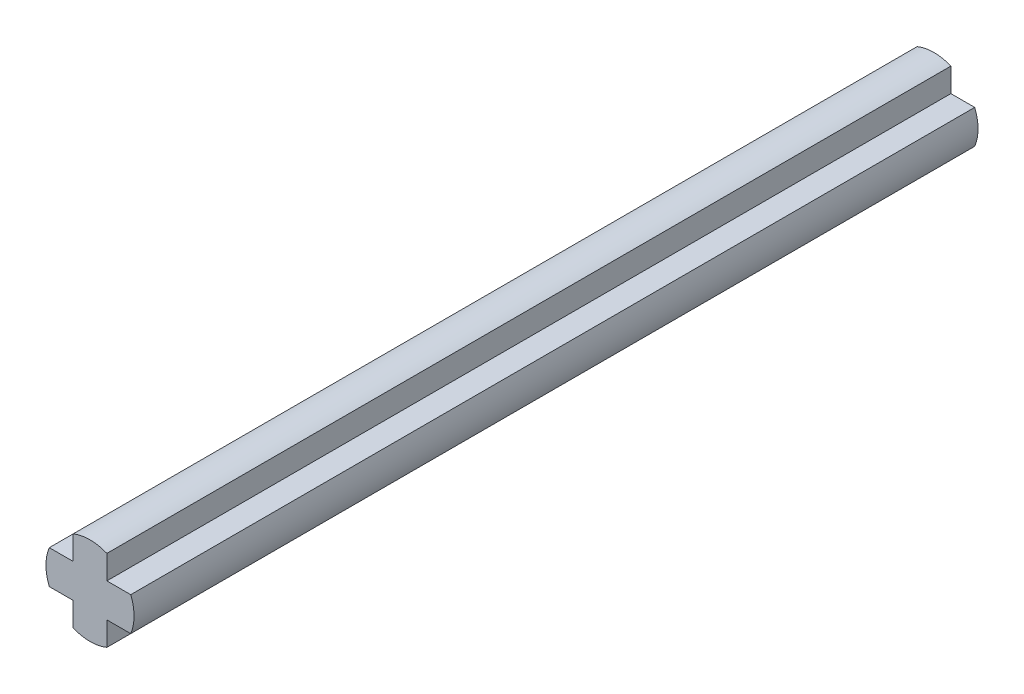
from build123d import *

# Parameters (mm, degrees)
BOSS_EXTRUDE1_DEPTH = 45


with BuildPart() as part:
    # Sketch1 → Boss-Extrude1 (new body)
    with BuildSketch(Plane.XY):
        with BuildLine():
            Line((-0.9, 2.170829335), (-0.9, 0.9))
            Line((-0.9, 0.9), (-2.170829335, 0.9))
            ThreePointArc((-2.170829335, 0.9), (-2.35, 0), (-2.170829335, -0.9))
            Line((-2.170829335, -0.9), (-0.9, -0.9))
            Line((-0.9, -0.9), (-0.9, -2.170829335))
            ThreePointArc((-0.9, -2.170829335), (0, -2.35), (0.9, -2.170829335))
            Line((0.9, -2.170829335), (0.9, -0.9))
            Line((0.9, -0.9), (2.170829335, -0.9))
            ThreePointArc((2.170829335, -0.9), (2.35, 0), (2.170829335, 0.9))
            Line((2.170829335, 0.9), (0.9, 0.9))
            Line((0.9, 0.9), (0.9, 2.170829335))
            ThreePointArc((0.9, 2.170829335), (0, 2.35), (-0.9, 2.170829335))
        make_face()
    extrude(amount=BOSS_EXTRUDE1_DEPTH)


solid = part.part
